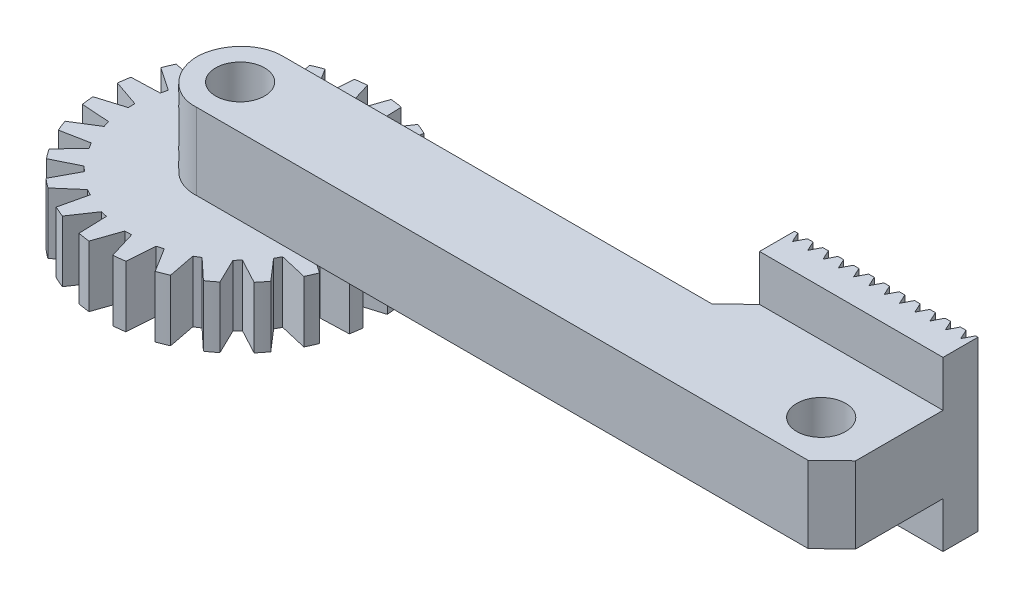
from build123d import *

# Parameters (mm, degrees)
ESQUISSE1_R                  = 9
BOSS_EXTRU_1_DEPTH           = 4
BOSS_EXTRU_2_DEPTH           = 5
ENL_V_MAT_EXTRU_1_DEPTH      = 10
ENL_V_MAT_EXTRU_1_DEPTH_BACK = 12
ESQUISSE3_R                  = 1.6
ENL_V_MAT_EXTRU_2_DEPTH      = 4
BOSS_EXTRU_3_DEPTH           = 3
BOSS_EXTRU_3_DEPTH_BACK      = 8
ESQUISSE5_W                  = 12
ESQUISSE5_H                  = 2.28739505
ENL_V_MAT_EXTRU_3_DEPTH      = 11
ESQUISSE7_R                  = 1.6
ENL_V_MAT_EXTRU_4_DEPTH      = 11


with BuildPart() as part:
    # Esquisse1 → Boss.-Extru.1 (new body)
    with BuildSketch(Plane(origin=(0, 0, 0), x_dir=(1, 0, 0), z_dir=(0, 1, 0))):
        with Locations(Location((0, 0, 0), (0, 0, 270))):
            Circle(ESQUISSE1_R)
    extrude(amount=BOSS_EXTRU_1_DEPTH)

    # Esquisse2 → Boss.-Extru.2 (add)
    with BuildSketch(Plane(origin=(0, 4, 0), x_dir=(1, 0, 0), z_dir=(0, 1, 0))):
        with BuildLine():
            Line((0, 2.856302475), (28, 2.856302475))
            Line((28, 2.856302475), (29.582547561, 4.38455089))
            Line((29.582547561, 4.38455089), (29.582547561, 6.67194594))
            Line((29.582547561, 6.67194594), (41.582547561, 6.67194594))
            Line((41.582547561, 6.67194594), (41.582547561, -1.32805406))
            Line((41.582547561, -1.32805406), (40, -2.856302475))
            Line((40, -2.856302475), (28, -2.856302475))
            Line((28, -2.856302475), (0, -2.856302475))
            add(Edge.make_bspline(
                [(0, 2.856302475), (-1.606608321, 2.917963895), (-4.109305793, 0.012086108), (-1.551274166, -2.952682253), (0, -2.856302475)],
                knots=[0, 0, 0, 0, 0.499550893, 1, 1, 1, 1], degree=3))
        make_face()
    extrude(amount=BOSS_EXTRU_2_DEPTH)

    # Esquisse3 → Enlèv. mat.-Extru.1 (cut, two sides: drawn at the far end of the back side and taken through both)
    with BuildSketch(Plane(origin=(0, 9, 0), x_dir=(1, 0, 0), z_dir=(0, 1, 0)).offset(-ENL_V_MAT_EXTRU_1_DEPTH_BACK)):
        with Locations(Location((0, 0, 0), (0, 0, 90))):
            Circle(ESQUISSE3_R)
    extrude(amount=ENL_V_MAT_EXTRU_1_DEPTH + ENL_V_MAT_EXTRU_1_DEPTH_BACK, mode=Mode.SUBTRACT)

    # Esquisse4 → Enlèv. mat.-Extru.2 (cut)
    with BuildSketch(Plane.XZ):
        Polygon((-1.417985005, -8.887593517), (-1.548540755, -7.052961635), (-1.968711567, -6.928820259), (-2.948701489, -8.503244059), (-2.361037532, -9.099305947), align=None)
        Polygon((-3.669946805, -8.217754587), (-3.321216304, -6.411845955), (-3.69493999, -6.183186386), (-5.04902843, -7.45032294), (-4.635660805, -8.178173136), align=None)
        Polygon((-5.671807795, -6.987889262), (-4.86755645, -5.33377357), (-5.169364359, -5.016178579), (-6.805272427, -5.889674625), (-6.594371455, -6.699711341), align=None)
        Polygon((-7.287144457, -5.281810832), (-6.082180668, -3.892213331), (-6.291505089, -3.507326492), (-8.097748355, -3.927654717), (-8.103686589, -4.76467529), align=None)
        Polygon((-8.405874267, -3.215785722), (-6.882314325, -2.185405185), (-6.984890145, -1.7594559), (-8.838376114, -1.697971632), (-9.060748873, -2.504934491), align=None)
        Polygon((-8.951757637, -0.93061013), (-7.213429634, -0.329665287), (-7.202266481, 0.108318704), (-8.976683148, 0.647425415), (-9.400336095, -0.074486547), align=None)
        Polygon((-8.887593517, 1.417985005), (-7.052961635, 1.548540755), (-6.928820259, 1.968711567), (-8.503244059, 2.948701489), (-9.099305947, 2.361037532), align=None)
        Polygon((-8.217754587, 3.669946805), (-6.411845955, 3.321216304), (-6.183186386, 3.69493999), (-7.45032294, 5.04902843), (-8.178173136, 4.635660805), align=None)
        Polygon((-6.987889262, 5.671807795), (-5.33377357, 4.86755645), (-5.016178579, 5.169364359), (-5.889674625, 6.805272427), (-6.699711341, 6.594371455), align=None)
        Polygon((-5.281810832, 7.287144457), (-3.892213331, 6.082180668), (-3.507326492, 6.291505089), (-3.927654717, 8.097748355), (-4.76467529, 8.103686589), align=None)
        Polygon((-3.215785722, 8.405874267), (-2.185405185, 6.882314325), (-1.7594559, 6.984890145), (-1.697971632, 8.838376114), (-2.504934491, 9.060748873), align=None)
        Polygon((-0.93061013, 8.951757637), (-0.329665287, 7.213429634), (0.108318704, 7.202266481), (0.647425415, 8.976683148), (-0.074486547, 9.400336095), align=None)
        Polygon((1.417985005, 8.887593517), (1.548540755, 7.052961635), (1.968711567, 6.928820259), (2.948701489, 8.503244059), (2.361037532, 9.099305947), align=None)
        Polygon((3.669946805, 8.217754587), (3.321216304, 6.411845955), (3.69493999, 6.183186386), (5.04902843, 7.45032294), (4.635660805, 8.178173136), align=None)
        Polygon((5.671807795, 6.987889262), (4.86755645, 5.33377357), (5.169364359, 5.016178579), (6.805272427, 5.889674625), (6.594371455, 6.699711341), align=None)
        Polygon((7.287144457, 5.281810832), (6.082180668, 3.892213331), (6.291505089, 3.507326492), (8.097748355, 3.927654717), (8.103686589, 4.76467529), align=None)
        Polygon((8.405874267, 3.215785722), (6.882314325, 2.185405185), (6.984890145, 1.7594559), (8.838376114, 1.697971632), (9.060748873, 2.504934491), align=None)
        Polygon((8.951757637, 0.93061013), (7.213429634, 0.329665287), (7.202266481, -0.108318704), (8.976683148, -0.647425415), (9.400336095, 0.074486547), align=None)
        Polygon((8.887593517, -1.417985005), (7.052961635, -1.548540755), (6.928820259, -1.968711567), (8.503244059, -2.948701489), (9.099305947, -2.361037532), align=None)
        Polygon((8.217754587, -3.669946805), (6.411845955, -3.321216304), (6.183186386, -3.69493999), (7.45032294, -5.04902843), (8.178173136, -4.635660805), align=None)
        Polygon((6.987889262, -5.671807795), (5.33377357, -4.86755645), (5.016178579, -5.169364359), (5.889674625, -6.805272427), (6.699711341, -6.594371455), align=None)
        Polygon((5.281810832, -7.287144457), (3.892213331, -6.082180668), (3.507326492, -6.291505089), (3.927654717, -8.097748355), (4.76467529, -8.103686589), align=None)
        Polygon((3.215785722, -8.405874267), (2.185405185, -6.882314325), (1.7594559, -6.984890145), (1.697971632, -8.838376114), (2.504934491, -9.060748873), align=None)
        Polygon((0.93061013, -8.951757637), (0.329665287, -7.213429634), (-0.108318704, -7.202266481), (-0.647425415, -8.976683148), (0.074486547, -9.400336095), align=None)
    extrude(amount=-ENL_V_MAT_EXTRU_2_DEPTH, mode=Mode.SUBTRACT)

    # Esquisse5 → Boss.-Extru.3 (add, two sides: drawn at the far end of the back side and taken through both)
    with BuildSketch(Plane(origin=(0, 9, 0), x_dir=(1, 0, 0), z_dir=(0, 1, 0)).offset(-BOSS_EXTRU_3_DEPTH_BACK)):
        with Locations((35.582547561, 5.528248415)):
            Rectangle(ESQUISSE5_W, ESQUISSE5_H)
    extrude(amount=BOSS_EXTRU_3_DEPTH + BOSS_EXTRU_3_DEPTH_BACK)

    # Esquisse6 → Enlèv. mat.-Extru.3 (cut)
    with BuildSketch(Plane(origin=(0, 12, 0), x_dir=(1, 0, 0), z_dir=(0, 1, 0))):
        Polygon((41.432080312, 6.67194594), (41.097414224, 6.023830859), (40.799482778, 6.67194594), (41.122702548, 7.12855331), align=None)
        Polygon((40.432080312, 6.67194594), (40.097414224, 6.023830859), (39.799482778, 6.67194594), (40.122702548, 7.12855331), align=None)
        Polygon((39.432080312, 6.67194594), (39.097414224, 6.023830859), (38.799482778, 6.67194594), (39.097414224, 7.165876079), align=None)
        Polygon((38.432080312, 6.67194594), (38.097414224, 6.023830859), (37.799482778, 6.67194594), (38.205026004, 7.165876079), align=None)
        Polygon((37.432080312, 6.67194594), (37.097414224, 6.023830859), (36.799482778, 6.67194594), (37.097414224, 7.165876079), align=None)
        Polygon((36.432080312, 6.67194594), (36.097414224, 6.023830859), (35.799482778, 6.67194594), (36.097414224, 7.165876079), align=None)
        Polygon((35.432080312, 6.67194594), (35.097414224, 6.023830859), (34.799482778, 6.67194594), (35.097414224, 7.165876079), align=None)
        Polygon((34.432080312, 6.67194594), (34.097414224, 6.023830859), (33.799482778, 6.67194594), (34.205026004, 7.165876079), align=None)
        Polygon((33.432080312, 6.67194594), (33.097414224, 6.023830859), (32.799482778, 6.67194594), (33.205026004, 7.165876079), align=None)
        Polygon((32.432080312, 6.67194594), (32.097414224, 6.023830859), (31.799482778, 6.67194594), (32.209344848, 7.15648094), align=None)
        Polygon((31.432080312, 6.67194594), (31.097414224, 6.023830859), (30.799482778, 6.67194594), (31.097414224, 6.955035779), align=None)
        Polygon((30.432080312, 6.67194594), (30.097414224, 6.023830859), (29.799482778, 6.67194594), (30.166939204, 7.248729466), align=None)
    extrude(amount=-ENL_V_MAT_EXTRU_3_DEPTH, mode=Mode.SUBTRACT)

    # Esquisse7 → Enlèv. mat.-Extru.4 (cut)
    with BuildSketch(Plane(origin=(0, 9, 0), x_dir=(1, 0, 0), z_dir=(0, 1, 0))):
        with Locations(Location((38, 0, 0), (0, 0, 270))):
            Circle(ESQUISSE7_R)
    extrude(amount=-ENL_V_MAT_EXTRU_4_DEPTH, mode=Mode.SUBTRACT)


solid = part.part
